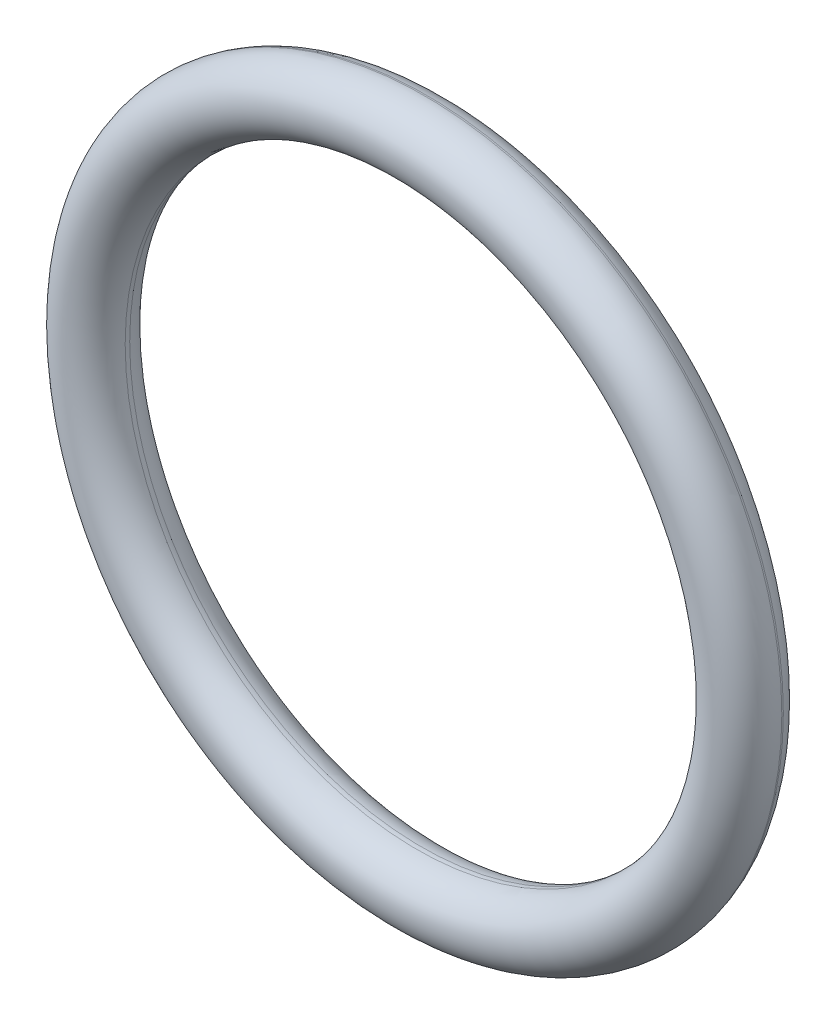
from build123d import *


with BuildPart() as part:
    # Esboço3 → Revolução1 (revolve)
    with BuildSketch(Plane(origin=(0, 0, 0), x_dir=(1, 0, 0), z_dir=(0, 1, 0))):
        with BuildLine():
            ThreePointArc((-5.303302637, 0.042621064), (-5.855684413, 0.573378755), (-6.482130586, 0.132476785))
            ThreePointArc((-6.482130586, 0.132476785), (-6.486707628, 0.114523732), (-6.490616398, 0.096413433))
            ThreePointArc((-6.490616398, 0.096413433), (-5.970516332, -0.616618258), (-5.3, -0.04274883))
            ThreePointArc((-5.3, -0.04274883), (-5.3, 0), (-5.303302637, 0.042621064))
        make_face()
    revolve(axis=Axis((0, 0, -88.99), (0, 0, 1)))


solid = part.part
